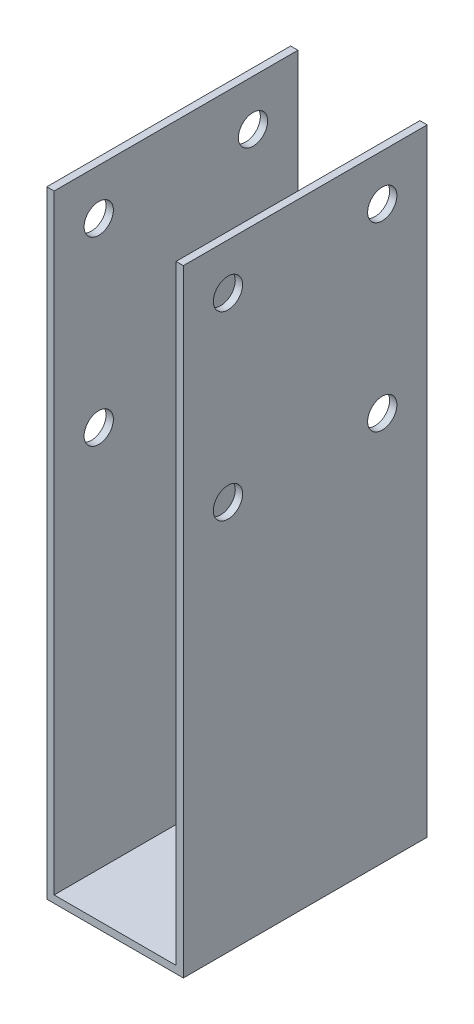
from build123d import *

# Parameters (mm, degrees)
SALIENTE_EXTRUIR1_DEPTH = 100
CROQUIS2_R              = 6
CORTAR_EXTRUIR1_DEPTH   = 172.813852759


with BuildPart() as part:
    # Croquis1 → Saliente-Extruir1 (new body)
    with BuildSketch(Plane.XY):
        Polygon((-28, 125), (-28, -128), (28, -128), (28, 125), (25, 125), (25, -125), (-25, -125), (-25, 125), align=None)
    extrude(amount=SALIENTE_EXTRUIR1_DEPTH)

    # Croquis2 → Cortar-Extruir1 (cut, through all)
    with BuildSketch(Plane(origin=(28, 0, 0), x_dir=(0, 0, -1), z_dir=(1, 0, 0))):
        with Locations(Location((-81.704212475, 106.115669713, 0), (0, 0, 90))):
            Circle(CROQUIS2_R)
        with Locations(Location((-18.434102118, 106.115669713, 0), (0, 0, 90))):
            Circle(CROQUIS2_R)
        with Locations(Location((-18.434102118, 31.828375961, 0), (0, 0, 90))):
            Circle(CROQUIS2_R)
        with Locations(Location((-81.704212475, 31.828375961, 0), (0, 0, 90))):
            Circle(CROQUIS2_R)
    extrude(amount=-CORTAR_EXTRUIR1_DEPTH, mode=Mode.SUBTRACT)


solid = part.part
